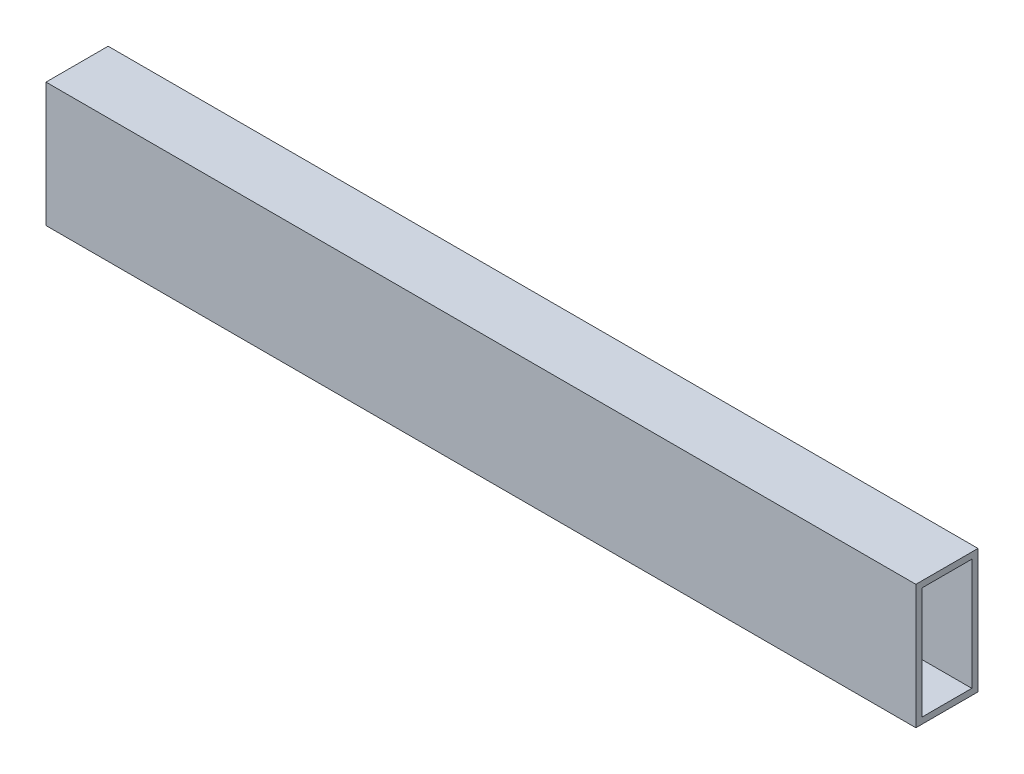
from build123d import *

# Parameters (mm, degrees)
SKETCH1_W           = 50
SKETCH1_H           = 100
SKETCH1_W_2         = 40
SKETCH1_H_2         = 90
BOSS_EXTRUDE1_DEPTH = 700


with BuildPart() as part:
    # Sketch1 → Boss-Extrude1 (new body)
    with BuildSketch(Plane(origin=(0, 0, 0), x_dir=(0, 0, -1), z_dir=(1, 0, 0))):
        with Locations((25, 50)):
            Rectangle(SKETCH1_W, SKETCH1_H)
        with Locations((25, 50)):
            Rectangle(SKETCH1_W_2, SKETCH1_H_2, mode=Mode.SUBTRACT)
    extrude(amount=BOSS_EXTRUDE1_DEPTH)


solid = part.part
